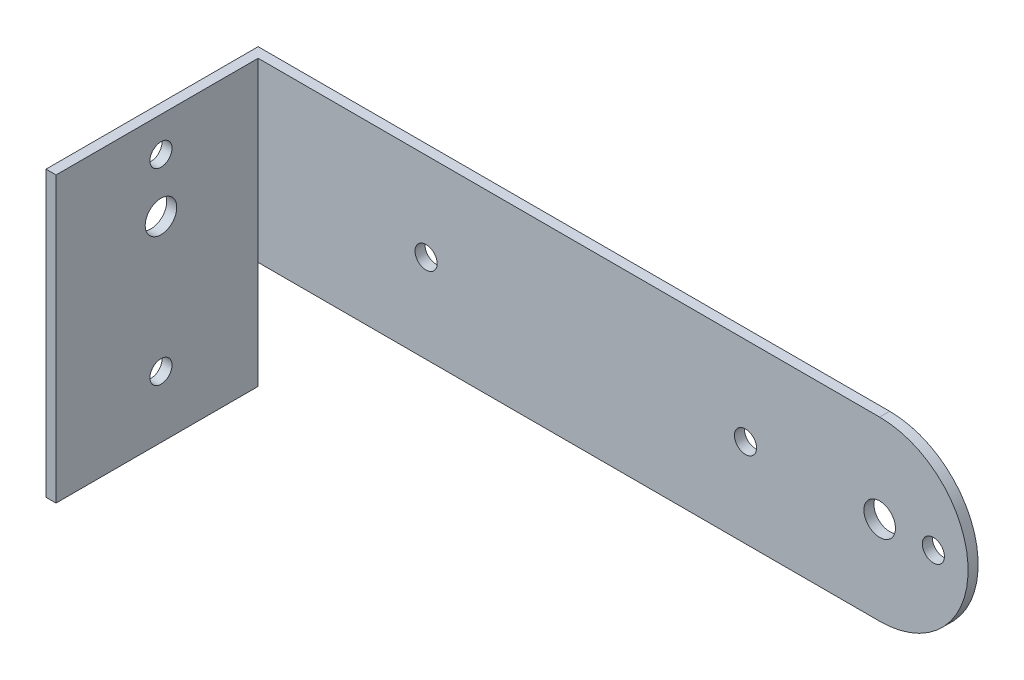
from build123d import *

# Parameters (mm, degrees)
BOSS_EXTRUDE1_DEPTH = 1.59
SKETCH2_W           = 1.59
SKETCH2_H           = 45
BOSS_EXTRUDE2_DEPTH = 32
SKETCH3_R           = 2.5
SKETCH3_R_2         = 1.75
CUT_EXTRUDE1_DEPTH  = 110.476024773
SKETCH4_R           = 2.5
SKETCH4_R_2         = 1.75
CUT_EXTRUDE2_DEPTH  = 123.822180814


with BuildPart() as part:
    # Sketch1 → Boss-Extrude1 (new body)
    with BuildSketch(Plane.XY):
        with BuildLine():
            Line((0, 14), (-100, 14))
            Line((-100, 14), (-100, -14))
            Line((-100, -14), (0, -14))
            ThreePointArc((0, -14), (14, 0), (0, 14))
        make_face()
    extrude(amount=BOSS_EXTRUDE1_DEPTH)

    # Sketch2 → Boss-Extrude2 (add)
    with BuildSketch(Plane.XY.offset(1.59)):
        with Locations((-99.205, -8.5)):
            Rectangle(SKETCH2_W, SKETCH2_H)
    extrude(amount=BOSS_EXTRUDE2_DEPTH)

    # Sketch3 → Cut-Extrude1 (cut, through all)
    with BuildSketch(Plane.XY.offset(1.59)):
        Circle(SKETCH3_R)
        with Locations((8.5, 0)):
            Circle(SKETCH3_R_2)
        with Locations((-21.25, 0)):
            Circle(SKETCH3_R_2)
        with Locations((-71.82, 0)):
            Circle(SKETCH3_R_2)
    extrude(amount=-CUT_EXTRUDE1_DEPTH, mode=Mode.SUBTRACT)

    # Sketch4 → Cut-Extrude2 (cut, through all)
    with BuildSketch(Plane.ZY.offset(100)):
        with Locations((16.975, 0)):
            Circle(SKETCH4_R)
        with Locations((16.975, 8.5)):
            Circle(SKETCH4_R_2)
        with Locations((16.975, -21.25)):
            Circle(SKETCH4_R_2)
    extrude(amount=-CUT_EXTRUDE2_DEPTH, mode=Mode.SUBTRACT)


solid = part.part
